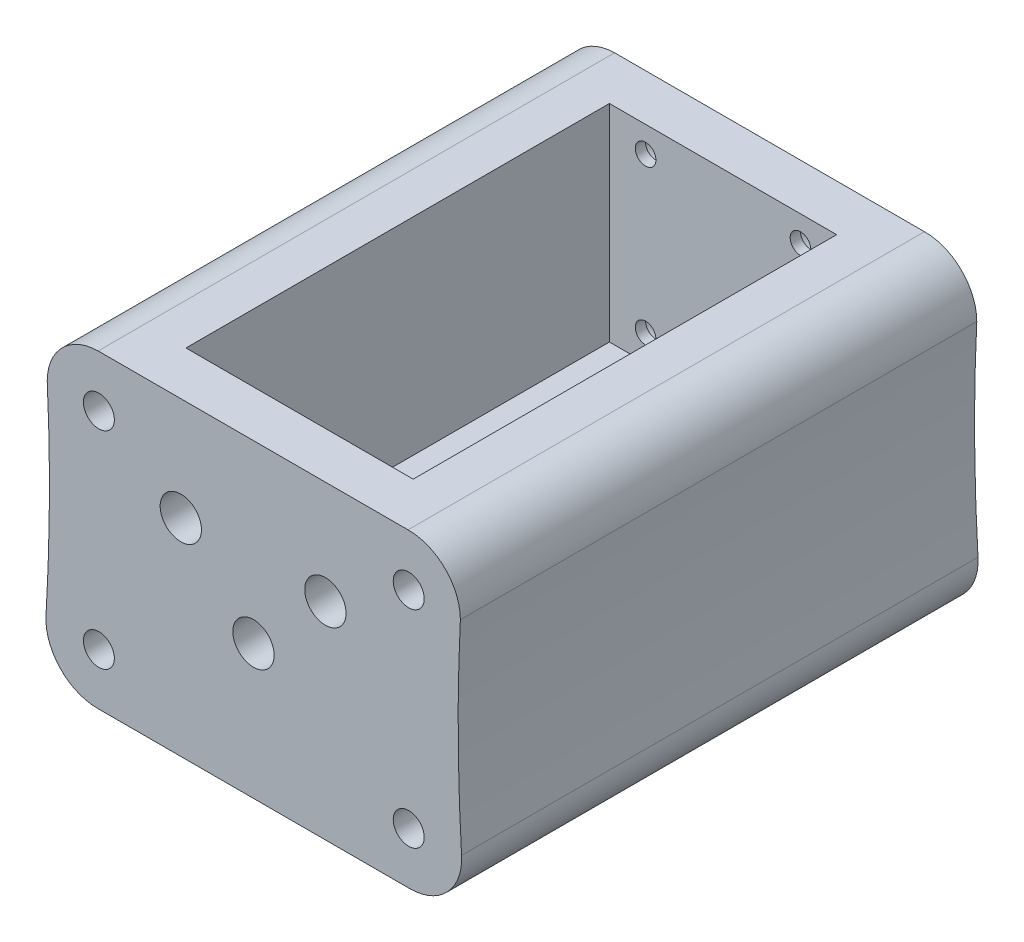
from build123d import *

# Parameters (mm, degrees)
SKETCH1_R             = 1.5
BOSS_EXTRUDE2_DEPTH   = 50
BODY_MOVE_COPY1_ANGLE = 45
SKETCH2_W             = 22
SKETCH2_H             = 41
CUT_EXTRUDE1_DEPTH    = 20
CUT_EXTRUDE6_REACH    = 248.506
SKETCH4_R             = 1
SKETCH5_R             = 2
CUT_EXTRUDE7_DEPTH    = 3.5
CUT_EXTRUDE11_REACH   = 248.506
SKETCH7_R             = 1
SKETCH8_R             = 2
CUT_EXTRUDE12_DEPTH   = 3.5
SKETCH9_R             = 1.5
CUT_EXTRUDE13_DEPTH   = 247.505542905
CUT_EXTRUDE14_DEPTH   = 247.505542905
FILLET1_R             = 5


with BuildPart() as part:
    # Sketch1 → Boss-Extrude2 (new body)
    with BuildSketch(Plane.XY):
        with BuildLine():
            Line((182.281997607, 145.957424373), (161.068794171, 167.170627808))
            ThreePointArc((161.068794171, 167.170627808), (157.547403451, 168.588083689), (154.045255639, 167.12372906))
            add(Edge.make_bspline(
                [(130.757413054, 145.551615227), (143.638496584, 155.63010859), (154.045255639, 167.12372906)],
                knots=[0.85894257, 0.85894257, 0.85894257, 1, 1, 1], degree=2))
            Line((130.757413054, 145.551615227), (160.757413054, 115.551615227))
            add(Edge.make_bspline(
                [(160.757413054, 115.551615227), (170.835906417, 128.432698758), (182.329526886, 138.839457812)],
                knots=[0.85894257, 0.85894257, 0.85894257, 1, 1, 1], degree=2))
            ThreePointArc((182.329526886, 138.839457812), (183.793881516, 142.408377812), (182.281997607, 145.957424373))
        make_face()
        with Locations((157.580789545, 163.588195154)):
            Circle(SKETCH1_R, mode=Mode.SUBTRACT)
        with Locations((178.79399298, 142.374991718)):
            Circle(SKETCH1_R, mode=Mode.SUBTRACT)
    extrude(amount=BOSS_EXTRUDE2_DEPTH)


with BuildPart() as part_1:
    # Body-Move/Copy1: moved
    add(part.part.rotate(Axis((157.275703017, 142.069905191, 0), (0, 0, 1)), BODY_MOVE_COPY1_ANGLE))

    # Sketch2 → Cut-Extrude1 (cut)
    with BuildSketch(Plane(origin=(0, 162.500916843, 0), x_dir=(1, 0, 0), z_dir=(0, 1, 0))):
        with Locations((157.208932318, -25)):
            Rectangle(SKETCH2_W, SKETCH2_H)
    extrude(amount=-CUT_EXTRUDE1_DEPTH, mode=Mode.SUBTRACT)

    # Sketch4 → Cut-Extrude6 (cut, up to next)
    with BuildSketch(Plane.XY.offset(50), mode=Mode.PRIVATE) as cut_extrude6_sk1:
        with Locations((150.208932318, 152.500916843)):
            Circle(SKETCH4_R)
    cut_extrude6_tool1 = extrude(cut_extrude6_sk1.sketch, amount=-CUT_EXTRUDE6_REACH, mode=Mode.PRIVATE) & part_1.part
    # Sketch4 → Cut-Extrude6 (cut, up to next)
    with BuildSketch(Plane.XY.offset(50), mode=Mode.PRIVATE) as cut_extrude6_sk2:
        with Locations((164.208932318, 152.500916843)):
            Circle(SKETCH4_R)
    cut_extrude6_tool2 = extrude(cut_extrude6_sk2.sketch, amount=-CUT_EXTRUDE6_REACH, mode=Mode.PRIVATE) & part_1.part
    # Sketch4 → Cut-Extrude6 (cut, up to next)
    with BuildSketch(Plane.XY.offset(50), mode=Mode.PRIVATE) as cut_extrude6_sk3:
        with Locations((157.245778438, 145.500039202)):
            Circle(SKETCH4_R)
    cut_extrude6_tool3 = extrude(cut_extrude6_sk3.sketch, amount=-CUT_EXTRUDE6_REACH, mode=Mode.PRIVATE) & part_1.part
    add(cut_extrude6_tool1.solids().sort_by_distance((150.208932, 152.500917, 50))[0], mode=Mode.SUBTRACT)
    add(cut_extrude6_tool2.solids().sort_by_distance((164.208932, 152.500917, 50))[0], mode=Mode.SUBTRACT)
    add(cut_extrude6_tool3.solids().sort_by_distance((157.245778, 145.500039, 50))[0], mode=Mode.SUBTRACT)

    # Sketch5 → Cut-Extrude7 (cut)
    with BuildSketch(Plane.XY.offset(50)):
        with Locations((150.208932318, 152.500916843)):
            Circle(SKETCH5_R)
        with Locations((164.208932318, 152.500916843)):
            Circle(SKETCH5_R)
        with Locations((157.245778438, 145.500039202)):
            Circle(SKETCH5_R)
    extrude(amount=-CUT_EXTRUDE7_DEPTH, mode=Mode.SUBTRACT)

    # Sketch7 → Cut-Extrude11 (cut, up to next)
    with BuildSketch(Plane(origin=(0, 0, 0), x_dir=(-1, 0, 0), z_dir=(0, 0, -1)), mode=Mode.PRIVATE) as cut_extrude11_sk1:
        with Locations((-149.708932317, 160.000916845)):
            Circle(SKETCH7_R)
    cut_extrude11_tool1 = extrude(cut_extrude11_sk1.sketch, amount=-CUT_EXTRUDE11_REACH, mode=Mode.PRIVATE) & part_1.part
    # Sketch7 → Cut-Extrude11 (cut, up to next)
    with BuildSketch(Plane(origin=(0, 0, 0), x_dir=(-1, 0, 0), z_dir=(0, 0, -1)), mode=Mode.PRIVATE) as cut_extrude11_sk2:
        with Locations((-164.70893232, 160.000916845)):
            Circle(SKETCH7_R)
    cut_extrude11_tool2 = extrude(cut_extrude11_sk2.sketch, amount=-CUT_EXTRUDE11_REACH, mode=Mode.PRIVATE) & part_1.part
    # Sketch7 → Cut-Extrude11 (cut, up to next)
    with BuildSketch(Plane(origin=(0, 0, 0), x_dir=(-1, 0, 0), z_dir=(0, 0, -1)), mode=Mode.PRIVATE) as cut_extrude11_sk3:
        with Locations((-149.708932317, 145.000916842)):
            Circle(SKETCH7_R)
    cut_extrude11_tool3 = extrude(cut_extrude11_sk3.sketch, amount=-CUT_EXTRUDE11_REACH, mode=Mode.PRIVATE) & part_1.part
    # Sketch7 → Cut-Extrude11 (cut, up to next)
    with BuildSketch(Plane(origin=(0, 0, 0), x_dir=(-1, 0, 0), z_dir=(0, 0, -1)), mode=Mode.PRIVATE) as cut_extrude11_sk4:
        with Locations((-164.70893232, 145.000916842)):
            Circle(SKETCH7_R)
    cut_extrude11_tool4 = extrude(cut_extrude11_sk4.sketch, amount=-CUT_EXTRUDE11_REACH, mode=Mode.PRIVATE) & part_1.part
    add(cut_extrude11_tool1.solids().sort_by_distance((149.708932, 160.000917, 0))[0], mode=Mode.SUBTRACT)
    add(cut_extrude11_tool2.solids().sort_by_distance((164.708932, 160.000917, 0))[0], mode=Mode.SUBTRACT)
    add(cut_extrude11_tool3.solids().sort_by_distance((149.708932, 145.000917, 0))[0], mode=Mode.SUBTRACT)
    add(cut_extrude11_tool4.solids().sort_by_distance((164.708932, 145.000917, 0))[0], mode=Mode.SUBTRACT)

    # Sketch8 → Cut-Extrude12 (cut)
    with BuildSketch(Plane(origin=(0, 0, 0), x_dir=(-1, 0, 0), z_dir=(0, 0, -1))):
        with Locations((-164.70893232, 160.000916845)):
            Circle(SKETCH8_R)
        with Locations((-149.708932317, 160.000916845)):
            Circle(SKETCH8_R)
        with Locations((-149.708932317, 145.000916842)):
            Circle(SKETCH8_R)
        with Locations((-164.70893232, 145.000916842)):
            Circle(SKETCH8_R)
    extrude(amount=-CUT_EXTRUDE12_DEPTH, mode=Mode.SUBTRACT)

    # Sketch9 → Cut-Extrude13 (cut, through all)
    with BuildSketch(Plane(origin=(0, 0, 0), x_dir=(-1, 0, 0), z_dir=(0, 0, -1))):
        with Locations((-172.275703017, 137.501362696)):
            Circle(SKETCH9_R)
        with Locations((-142.275703017, 137.501362696)):
            Circle(SKETCH9_R)
    extrude(amount=-CUT_EXTRUDE13_DEPTH, mode=Mode.SUBTRACT)

    # Sketch10 → Cut-Extrude14 (cut, through all)
    with BuildSketch(Plane(origin=(0, 0, 0), x_dir=(-1, 0, 0), z_dir=(0, 0, -1))):
        with BuildLine():
            Line((-136.767866361, 132.501362696), (-177.783539673, 132.501362696))
            add(Edge.make_bspline(
                [(-177.783539673, 132.501362696), (-178.076738818, 129.157172087), (-178.488906453, 125.780583309)],
                knots=[0.970662354, 0.970662354, 0.970662354, 1, 1, 1], degree=2))
            Line((-178.488906453, 125.780583309), (-136.062499581, 125.780583309))
            add(Edge.make_bspline(
                [(-136.062499581, 125.780583309), (-136.474667216, 129.157172087), (-136.767866361, 132.501362696)],
                knots=[0.85894257, 0.85894257, 0.85894257, 0.888280216, 0.888280216, 0.888280216], degree=2))
        make_face()
    extrude(amount=-CUT_EXTRUDE14_DEPTH, mode=Mode.SUBTRACT)

    # Fillet1
    fillet1_edges = [part_1.edges().sort_by_distance(p)[0] for p in [
        (136.767866361, 132.501362696, 25),
        (177.783539673, 132.501362696, 25),
    ]]
    fillet(fillet1_edges, radius=FILLET1_R)


solid = part_1.part
